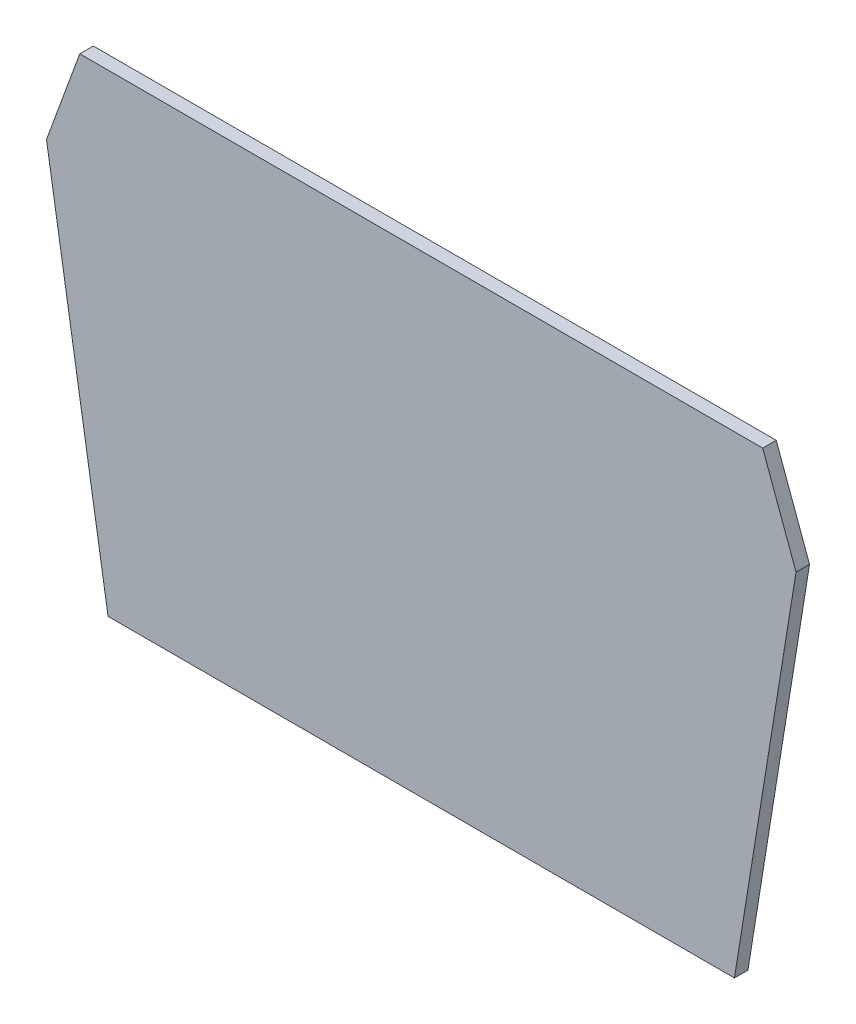
from build123d import *

# Parameters (mm, degrees)
BOSS_EXTRUDE1_DEPTH = 12.7


with BuildPart() as part:
    # Sketch1 → Boss-Extrude1 (new body)
    with BuildSketch(Plane.XY):
        Polygon((-320.836522371, 413.70259906), (320.836522371, 413.70259906), (352.146351869, 328.386767557), (294.276699266, -30.79740094), (-294.276699266, -30.79740094), (-352.146351869, 328.386767557), align=None)
    extrude(amount=BOSS_EXTRUDE1_DEPTH)


solid = part.part
